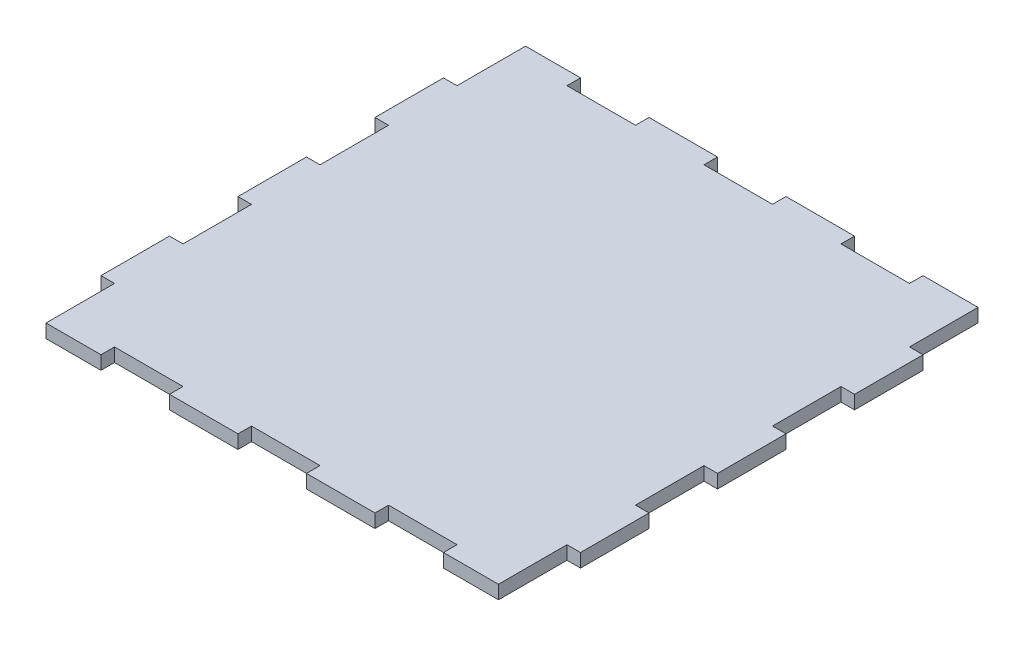
from build123d import *

# Parameters (mm, degrees)
SKETCH1_W           = 6.35
SKETCH1_H           = 32.142857142
SKETCH1_H_2         = 32.142857143
SKETCH1_W_2         = 25.792857143
SKETCH1_H_3         = 6.35
SKETCH1_W_3         = 32.142857143
BOSS_EXTRUDE1_DEPTH = 6.35


with BuildPart() as part:
    # Sketch1 → Boss-Extrude1 (new body)
    with BuildSketch(Plane(origin=(0, 0, 0), x_dir=(1, 0, 0), z_dir=(0, 1, 0))):
        Polygon((6.35, 6.35), (32.142857143, 6.35), (64.285714286, 6.35), (96.428571429, 6.35), (128.571428571, 6.35), (160.714285714, 6.35), (192.857142857, 6.35), (218.65, 6.35), (218.65, 32.142857143), (218.65, 64.285714286), (218.65, 96.428571429), (218.65, 128.571428571), (218.65, 160.714285714), (218.65, 192.857142857), (218.65, 218.65), (192.857142857, 218.65), (160.714285714, 218.65), (128.571428571, 218.65), (96.428571429, 218.65), (64.285714286, 218.65), (32.142857143, 218.65), (6.35, 218.65), (6.35, 192.857142857), (6.35, 160.714285714), (6.35, 128.571428571), (6.35, 96.428571429), (6.35, 64.285714286), (6.35, 32.142857143), align=None)
        with Locations((3.175, 112.5)):
            Rectangle(SKETCH1_W, SKETCH1_H)
        with Locations((3.175, 48.214285715)):
            Rectangle(SKETCH1_W, SKETCH1_H_2)
        with Locations((3.175, 176.785714286)):
            Rectangle(SKETCH1_W, SKETCH1_H_2)
        with Locations((19.246428572, 3.175)):
            Rectangle(SKETCH1_W_2, SKETCH1_H_3)
        with Locations((80.357142858, 3.175)):
            Rectangle(SKETCH1_W_3, SKETCH1_H_3)
        with Locations((144.642857143, 3.175)):
            Rectangle(SKETCH1_W_3, SKETCH1_H_3)
        with Locations((205.753571429, 3.175)):
            Rectangle(SKETCH1_W_2, SKETCH1_H_3)
        with Locations((221.825, 48.214285715)):
            Rectangle(SKETCH1_W, SKETCH1_H_2)
        with Locations((221.825, 112.5)):
            Rectangle(SKETCH1_W, SKETCH1_H)
        with Locations((221.825, 176.785714286)):
            Rectangle(SKETCH1_W, SKETCH1_H_2)
        with Locations((205.753571429, 221.825)):
            Rectangle(SKETCH1_W_2, SKETCH1_H_3)
        with Locations((144.642857143, 221.825)):
            Rectangle(SKETCH1_W_3, SKETCH1_H_3)
        with Locations((80.357142858, 221.825)):
            Rectangle(SKETCH1_W_3, SKETCH1_H_3)
        with Locations((19.246428572, 221.825)):
            Rectangle(SKETCH1_W_2, SKETCH1_H_3)
    extrude(amount=BOSS_EXTRUDE1_DEPTH)


solid = part.part
